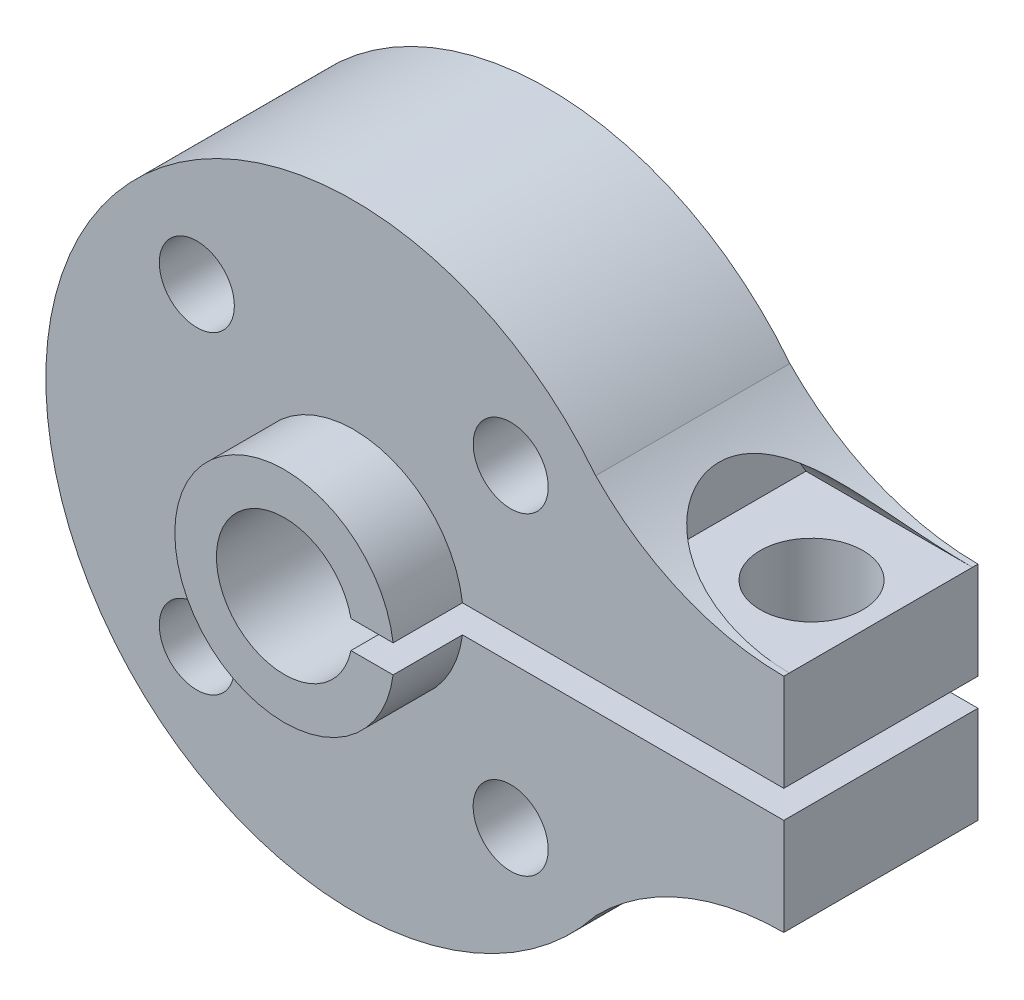
from build123d import *

# Parameters (mm, degrees)
EXTRUDE1_DEPTH            = 7
F_6_32_TAPPED_HOLE3_D     = 2.7051
EXTRUDE3_DEPTH            = 2.5
SKETCH9_R                 = 2.45
CUT_EXTRUDE3_DEPTH        = 22.300469478
SKETCH14_R                = 1.85
CUT_EXTRUDE6_DEPTH        = 21.586646157
F_6_32_TAPPED_HOLE5_D     = 2.7051
F_6_32_TAPPED_HOLE5_DEPTH = 50.8
F_6_32_TAPPED_HOLE5_TIP   = 0.81269403
CUT_EXTRUDE26_DEPTH       = 6


with BuildPart() as part:
    # Sketch1 → Extrude1 (new body)
    with BuildSketch(Plane.XY):
        with BuildLine():
            Line((0, 0), (0, 0.5))
            Line((0, 0.5), (15.5, 0.5))
            Line((15.5, 0.5), (15.5, 4))
            ThreePointArc((15.5, 4), (11.819050527, 4.746581358), (8.719864541, 6.868330393))
            ThreePointArc((8.719864541, 6.868330393), (-11.1, 0), (8.719864541, -6.868330393))
            ThreePointArc((8.719864541, -6.868330393), (11.819050527, -4.746581358), (15.5, -4))
            Line((15.5, -4), (15.5, -0.5))
            Line((15.5, -0.5), (0, -0.5))
            Line((0, -0.5), (0, 0))
        make_face()
    extrude(amount=-EXTRUDE1_DEPTH)

    # #6-32 Tapped Hole3 (through all)
    with Locations(Plane(origin=(-5.656516225, 5.657192254, 0), x_dir=(1, 0, 0), z_dir=(0, 0, 1))):
        with Locations((0, 0), (11.313708479, -0.000676029), (11.31303245, -11.314384508), (-0.000676029, -11.313708479)):
            Hole(F_6_32_TAPPED_HOLE3_D / 2)

    # Sketch8 → Extrude3 (add)
    with BuildSketch(Plane.XY):
        with BuildLine():
            Line((3.91822664, -0.5), (0, -0.5))
            Line((0, -0.5), (0, 0.5))
            Line((0, 0.5), (3.91822664, 0.5))
            ThreePointArc((3.91822664, 0.5), (-3.95, 0), (3.91822664, -0.5))
        make_face()
    extrude(amount=EXTRUDE3_DEPTH)

    # Sketch9 → Cut-Extrude3 (cut, through all)
    with BuildSketch(Plane.XY.offset(2.5)):
        Circle(SKETCH9_R)
    extrude(amount=-CUT_EXTRUDE3_DEPTH, mode=Mode.SUBTRACT)

    # Sketch14 → Cut-Extrude6 (cut, through all)
    with BuildSketch(Plane.XZ.offset(-0.5)):
        with Locations(Location((13, -3.5, 0), (0, 0, 270))):
            Circle(SKETCH14_R)
    extrude(amount=-CUT_EXTRUDE6_DEPTH, mode=Mode.SUBTRACT)

    # #6-32 Tapped Hole5
    with Locations(Plane(origin=(0, -0.5, 0), x_dir=(-1, 0, 0), z_dir=(0, 1, 0))):
        with Locations((-13, -3.5)):
            Hole(F_6_32_TAPPED_HOLE5_D / 2, depth=F_6_32_TAPPED_HOLE5_DEPTH)
            with Locations((0, 0, -(F_6_32_TAPPED_HOLE5_DEPTH + F_6_32_TAPPED_HOLE5_TIP / 2))):  # 118° drill point
                Cone(0, F_6_32_TAPPED_HOLE5_D / 2, F_6_32_TAPPED_HOLE5_TIP, mode=Mode.SUBTRACT)

    # Sketch24 → Cut-Extrude26 (cut)
    with BuildSketch(Plane(origin=(15.5, 0, 0), x_dir=(0, 0, -1), z_dir=(1, 0, 0))):
        with BuildLine():
            Line((0.2, 4), (6.8, 4))
            ThreePointArc((6.8, 4), (3.5, 6.016591059), (0.2, 4))
        make_face()
    extrude(amount=-CUT_EXTRUDE26_DEPTH, mode=Mode.SUBTRACT)


solid = part.part
